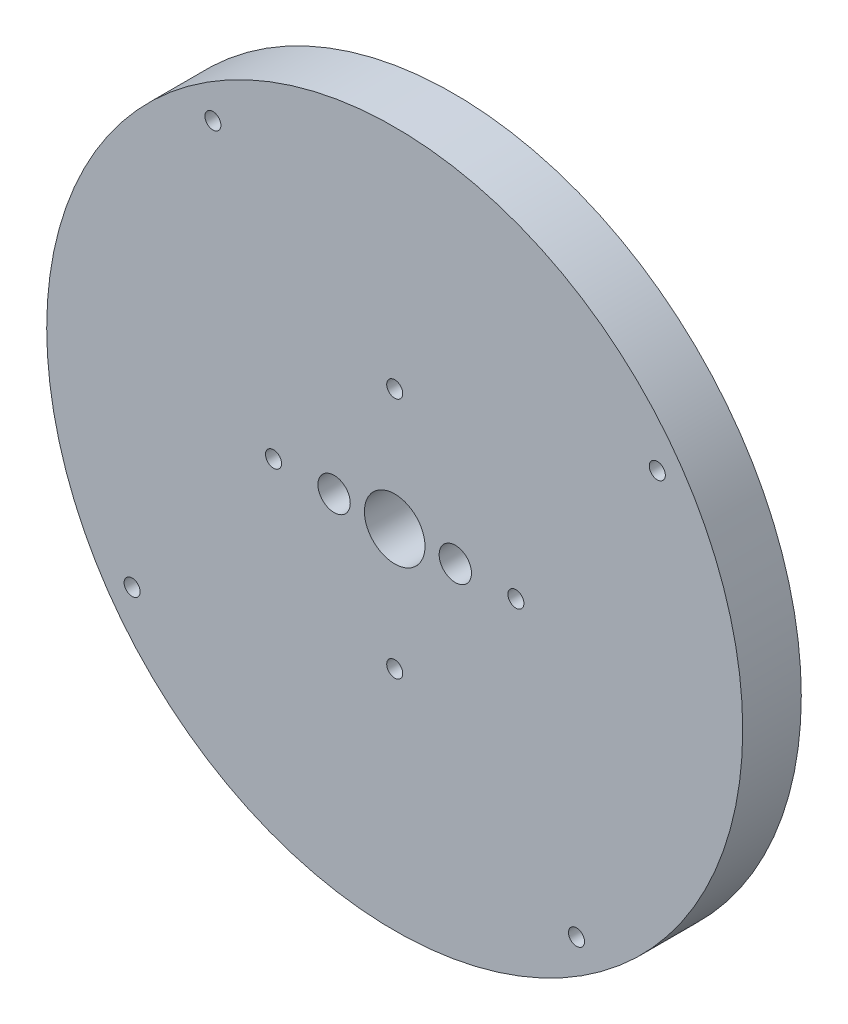
from build123d import *

# Parameters (mm, degrees)
SKETCH1_R                = 34.458333333
SKETCH1_R_2              = 3
BOSS_EXTRUDE1_DEPTH      = 5.8
SKETCH2_R                = 0.79375
CUT_EXTRUDE1_DEPTH       = 50.075385604
M3_CLEARANCE_HOLE1_D     = 3.2
M3_CLEARANCE_HOLE1_DEPTH = 12.7
M3_CLEARANCE_HOLE1_TIP   = 0.96137699


with BuildPart() as part:
    # Sketch1 → Boss-Extrude1 (new body)
    with BuildSketch(Plane.XY):
        Circle(SKETCH1_R)
        Circle(SKETCH1_R_2, mode=Mode.SUBTRACT)
    extrude(amount=BOSS_EXTRUDE1_DEPTH)

    # Sketch2 → Cut-Extrude1 (cut, through all)
    with BuildSketch(Plane.XY.offset(5.8)):
        with Locations((0, 12)):
            Circle(SKETCH2_R)
        with Locations((12, 0)):
            Circle(SKETCH2_R)
        with Locations((0, -12)):
            Circle(SKETCH2_R)
        with Locations((-12, 0)):
            Circle(SKETCH2_R)
        with Locations((-18, 26)):
            Circle(SKETCH2_R)
        with Locations((26, 18)):
            Circle(SKETCH2_R)
        with Locations((18, -26)):
            Circle(SKETCH2_R)
        with Locations((-26, -18)):
            Circle(SKETCH2_R)
    extrude(amount=-CUT_EXTRUDE1_DEPTH, mode=Mode.SUBTRACT)

    # M3 Clearance Hole1
    with Locations(Plane.XY.offset(5.8)):
        with Locations((-6, 0), (6, 0)):
            Hole(M3_CLEARANCE_HOLE1_D / 2, depth=M3_CLEARANCE_HOLE1_DEPTH)
            with Locations((0, 0, -(M3_CLEARANCE_HOLE1_DEPTH + M3_CLEARANCE_HOLE1_TIP / 2))):  # 118° drill point
                Cone(0, M3_CLEARANCE_HOLE1_D / 2, M3_CLEARANCE_HOLE1_TIP, mode=Mode.SUBTRACT)


solid = part.part
